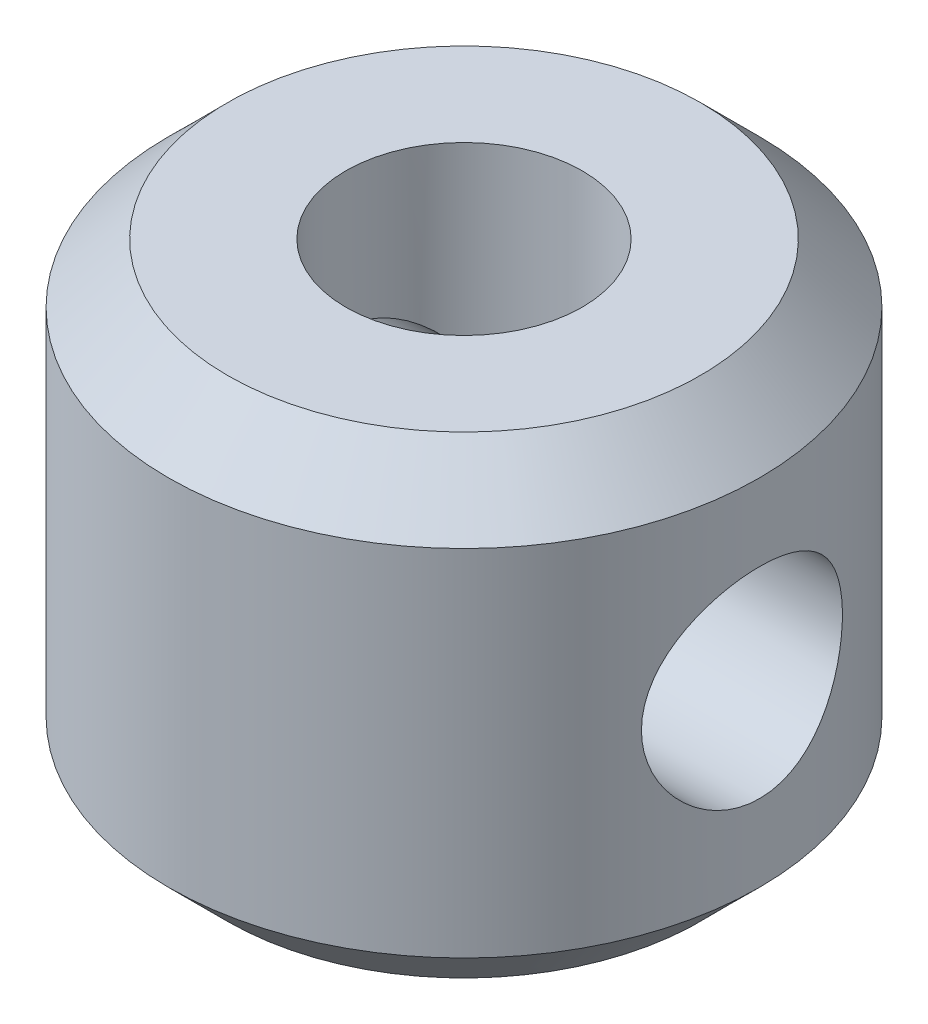
from build123d import *

# Parameters (mm, degrees)
BOSS_EXTRUDE1_DEPTH      = 8
BOSS_EXTRUDE1_DEPTH_BACK = 8
SKETCH2_R                = 10
SKETCH2_R_2              = 4
CUT_EXTRUDE1_DEPTH       = 20
CUT_EXTRUDE1_DEPTH_BACK  = 20
SKETCH3_R                = 3.4
CHAMFER1_SIZE            = 2


with BuildPart() as part:
    # Sketch2 → Boss-Extrude1 (new, two sides: drawn at the far end of the back side and taken through both)
    with BuildSketch(Plane(origin=(0, 0, 0), x_dir=(1, 0, 0), z_dir=(0, 1, 0)).offset(-BOSS_EXTRUDE1_DEPTH_BACK)):
        Circle(SKETCH2_R)
        Circle(SKETCH2_R_2, mode=Mode.SUBTRACT)
    extrude(amount=BOSS_EXTRUDE1_DEPTH + BOSS_EXTRUDE1_DEPTH_BACK)

    # Sketch3 → Cut-Extrude1 (cut, two sides: drawn at the far end of the back side and taken through both)
    with BuildSketch(Plane(origin=(0, 0, 0), x_dir=(0, 0, -1), z_dir=(1, 0, 0)).offset(-CUT_EXTRUDE1_DEPTH_BACK)):
        Circle(SKETCH3_R)
    extrude(amount=CUT_EXTRUDE1_DEPTH + CUT_EXTRUDE1_DEPTH_BACK, mode=Mode.SUBTRACT)

    # Chamfer1
    chamfer1_edges = [part.edges().sort_by_distance(p)[0] for p in [
        (-10, -8, 0),
        (-10, 8, 0),
    ]]
    chamfer(chamfer1_edges, length=CHAMFER1_SIZE)


solid = part.part
